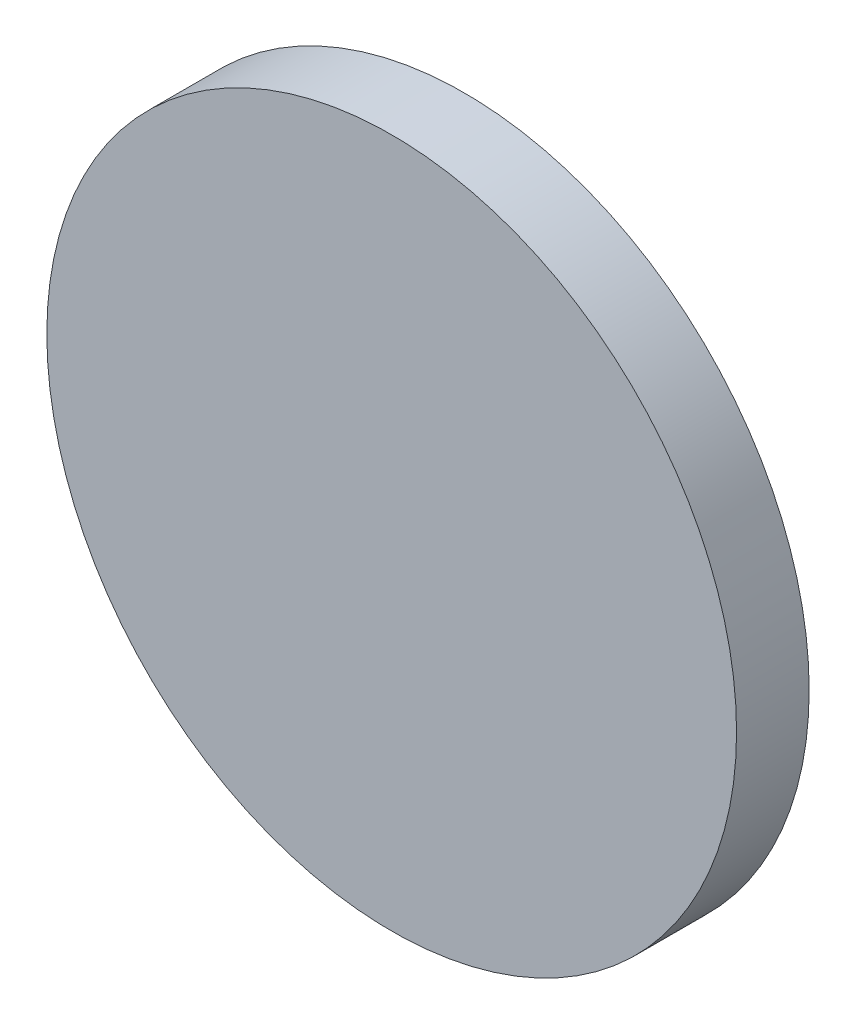
from build123d import *

# Parameters (mm, degrees)
CROQUIS1_R              = 9.5
SALIENTE_EXTRUIR1_DEPTH = 2


with BuildPart() as part:
    # Croquis1 → Saliente-Extruir1 (new body)
    with BuildSketch(Plane.XY):
        Circle(CROQUIS1_R)
    extrude(amount=SALIENTE_EXTRUIR1_DEPTH)


solid = part.part
